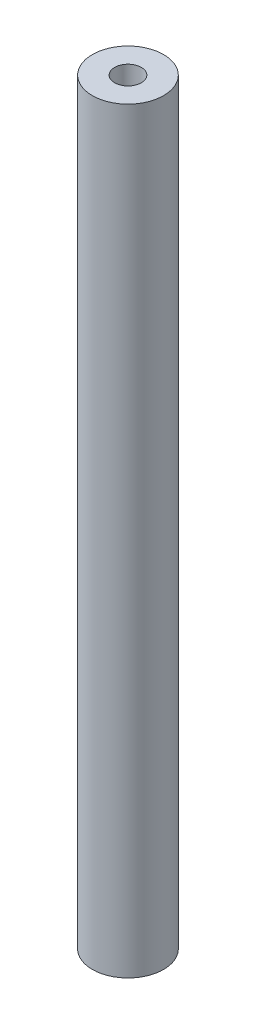
from build123d import *

# Parameters (mm, degrees)
SKETCH1_R           = 4
SKETCH1_R_2         = 1.5
BOSS_EXTRUDE1_DEPTH = 85


with BuildPart() as part:
    # Sketch1 → Boss-Extrude1 (new body)
    with BuildSketch(Plane(origin=(0, 0, 0), x_dir=(1, 0, 0), z_dir=(0, 1, 0))):
        with Locations(Location((0, 0, 0), (0, 0, 270))):
            Circle(SKETCH1_R)
        with Locations(Location((0, 0, 0), (0, 0, 270))):
            Circle(SKETCH1_R_2, mode=Mode.SUBTRACT)
    extrude(amount=BOSS_EXTRUDE1_DEPTH)


solid = part.part
